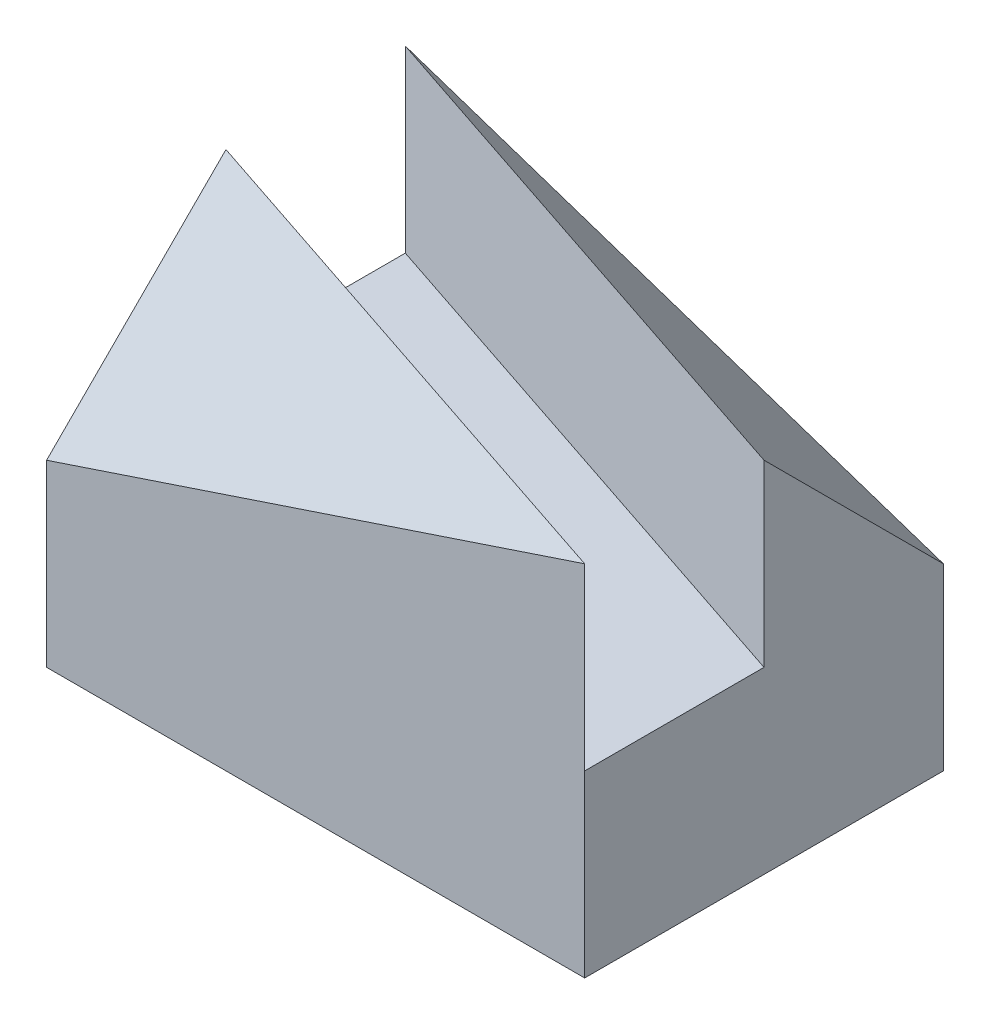
from build123d import *

# Parameters (mm, degrees)
SKETCH_1_W          = 6
SKETCH_1_H          = 4
EXTRUDE_1_DEPTH     = 2
EXTRUDE_2_DEPTH     = 2
EXTRUDE_3_DEPTH     = 2
CUT_EXTRUDE_1_DEPTH = 2
CUT_EXTRUDE_2_DEPTH = 2


with BuildPart() as part:
    # 草圖1 → 填料-伸長1 (new body)
    with BuildSketch(Plane(origin=(0, 0, 0), x_dir=(1, 0, 0), z_dir=(0, 1, 0))):
        with Locations((3, 2)):
            Rectangle(SKETCH_1_W, SKETCH_1_H)
    extrude(amount=EXTRUDE_1_DEPTH)

    # 草圖2 → 填料-伸長2 (add)
    with BuildSketch(Plane(origin=(0, 2, 0), x_dir=(1, 0, 0), z_dir=(0, 1, 0))):
        Polygon((0, 4), (6, 2), (6, 4), align=None)
    extrude(amount=EXTRUDE_2_DEPTH)

    # 草圖4 → 填料-伸長3 (add)
    with BuildSketch(Plane(origin=(0, 2, 0), x_dir=(1, 0, 0), z_dir=(0, 1, 0))):
        Polygon((0, 0), (0, 2), (6, 0), align=None)
    extrude(amount=EXTRUDE_3_DEPTH)

    # Sketch 3D_1 → 除料-伸長1 (cut, along a direction that is not the sketch's normal)
    with BuildSketch(Plane(origin=(6, 2, -4), x_dir=(-0.9486832980505139, 0.316227766016838, 0), z_dir=(0.2294157338705617, 0.6882472016116854, -0.6882472016116854))):
        Polygon((0, 0), (0.632455532, 2.75680975), (6.32455532, 0), align=None)
    extrude(amount=CUT_EXTRUDE_1_DEPTH, dir=(0, 1, 0), mode=Mode.SUBTRACT)

    # Sketch 3D_2 → 除料-伸長2 (cut, along a direction that is not the sketch's normal)
    with BuildSketch(Plane(origin=(0, 2, 0), x_dir=(0.9486832980505139, 0.316227766016838, 0), z_dir=(-0.22941573387056177, 0.6882472016116853, 0.6882472016116854))):
        Polygon((0, 0), (0.632455532, 2.75680975), (6.32455532, 0), align=None)
    extrude(amount=CUT_EXTRUDE_2_DEPTH, dir=(0, 0, 1), mode=Mode.SUBTRACT)


solid = part.part
